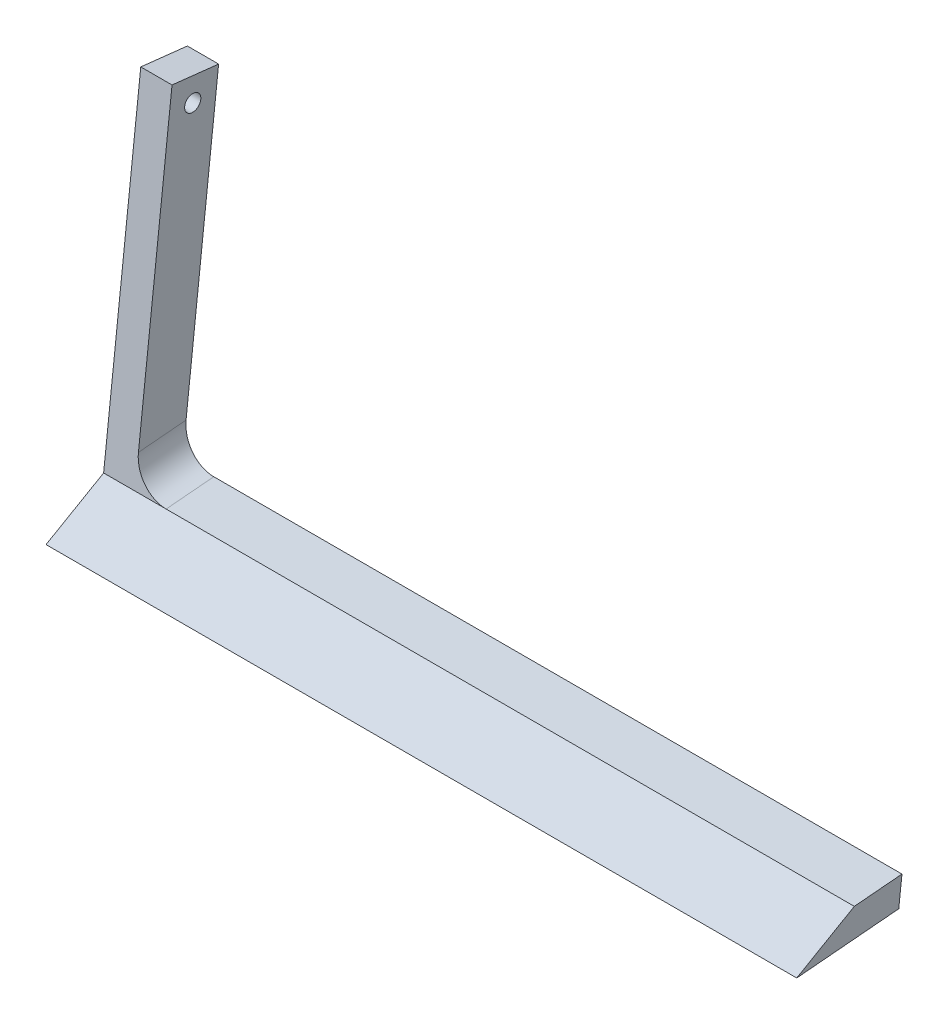
from build123d import *

# Parameters (mm, degrees)
SKETCH1_R           = 0.5
SKETCH1_R_2         = 2.35
BOSS_EXTRUDE1_DEPTH = 6.35
BOSS_EXTRUDE2_DEPTH = 146.15
FILLET1_R           = 6.35
BOSS_EXTRUDE3_START = -3.175
SKETCH3_R           = 2.35
SKETCH3_R_2         = 1.65
BOSS_EXTRUDE3_DEPTH = 3.175


with BuildPart() as part:
    # Sketch1 → Boss-Extrude1 (new body)
    # profile 1 of 6: a face of its own
    with BuildSketch(Plane(origin=(-0.241133717, 0, 0), x_dir=(0, 0, -1), z_dir=(1, 0, 0))):
        Polygon((-324.298707694, 301.481270763), (-335.997730617, 294.726836729), (-315.265512147, 296.540670815), (-310.789920597, 336.684836729), (-320.373933602, 336.684836729), align=None)
    # profile 2 of 6: a face of its own
    with BuildSketch(Plane(origin=(-0.241133717, 0, 0), x_dir=(0, 0, -1), z_dir=(1, 0, 0))):
        with BuildLine():
            Line((-320.373933602, 336.684836729), (-310.789920597, 336.684836729))
            Line((-310.789920597, 336.684836729), (-308.183073809, 360.067151412))
            ThreePointArc((-308.183073809, 360.067151412), (-308.561069009, 359.673805672), (-308.974348052, 359.317713441))
            ThreePointArc((-308.974348052, 359.317713441), (-309.402003012, 358.785726579), (-309.54965251, 358.119319487))
            ThreePointArc((-309.54965251, 358.119319487), (-312.549454326, 355.084836729), (-315.549256143, 358.119319487))
            ThreePointArc((-315.549256143, 358.119319487), (-315.696905641, 358.785726579), (-316.124560601, 359.317713441))
            ThreePointArc((-316.124560601, 359.317713441), (-316.979869903, 360.141653883), (-317.649424173, 361.122535594))
            Line((-317.649424173, 361.122535594), (-320.373933602, 336.684836729))
        make_face()
        with Locations((-312.549454326, 344.184836729)):
            Circle(SKETCH1_R, mode=Mode.SUBTRACT)
    # profile 3 of 6: a face of its own
    with BuildSketch(Plane(origin=(-0.241133717, 0, 0), x_dir=(0, 0, -1), z_dir=(1, 0, 0))):
        with BuildLine():
            ThreePointArc((-308.974348052, 359.317713441), (-308.561069009, 359.673805672), (-308.183073809, 360.067151412))
            Line((-308.183073809, 360.067151412), (-307.449484479, 366.647137863))
            ThreePointArc((-307.449484479, 366.647137863), (-308.019066808, 367.506381831), (-308.73176901, 368.251217246))
            Line((-308.73176901, 368.251217246), (-315.311755461, 368.984806576))
            ThreePointArc((-315.311755461, 368.984806576), (-316.170999429, 368.415224248), (-316.915834844, 367.702522045))
            Line((-316.915834844, 367.702522045), (-317.649424173, 361.122535594))
            ThreePointArc((-317.649424173, 361.122535594), (-316.979869903, 360.141653883), (-316.124560601, 359.317713441))
            ThreePointArc((-316.124560601, 359.317713441), (-315.696905641, 358.785726579), (-315.549256143, 358.119319487))
            ThreePointArc((-315.549256143, 358.119319487), (-312.549454326, 355.084836729), (-309.54965251, 358.119319487))
            ThreePointArc((-309.54965251, 358.119319487), (-309.402003012, 358.785726579), (-308.974348052, 359.317713441))
        make_face()
        with Locations(Location((-312.549454326, 363.884836729, 0), (0, 0, 90))):
            Circle(SKETCH1_R_2, mode=Mode.SUBTRACT)
    # profile 4 of 6: a face of its own
    with BuildSketch(Plane(origin=(-0.241133717, 0, 0), x_dir=(0, 0, -1), z_dir=(1, 0, 0))):
        with BuildLine():
            ThreePointArc((-308.73176901, 368.251217246), (-308.019066808, 367.506381831), (-307.449484479, 366.647137863))
            Line((-307.449484479, 366.647137863), (-307.288587053, 368.09031982))
            Line((-307.288587053, 368.09031982), (-308.73176901, 368.251217246))
        make_face()
    # profile 5 of 6: a face of its own
    with BuildSketch(Plane(origin=(-0.241133717, 0, 0), x_dir=(0, 0, -1), z_dir=(1, 0, 0))):
        with BuildLine():
            Line((-316.754937418, 369.145704002), (-316.915834844, 367.702522045))
            ThreePointArc((-316.915834844, 367.702522045), (-316.170999429, 368.415224248), (-315.311755461, 368.984806576))
            Line((-315.311755461, 368.984806576), (-316.754937418, 369.145704002))
        make_face()
    # profile 6 of 6: a face of its own
    with BuildSketch(Plane(origin=(-0.241133717, 0, 0), x_dir=(0, 0, -1), z_dir=(1, 0, 0))):
        with Locations((-312.549454326, 344.184836729)):
            Circle(SKETCH1_R)
    extrude(amount=BOSS_EXTRUDE1_DEPTH)

    # Sketch2 → Boss-Extrude2 (add)
    with BuildSketch(Plane(origin=(6.108866283, 0, 0), x_dir=(0, 0, -1), z_dir=(1, 0, 0))):
        Polygon((-324.298707694, 301.481270763), (-314.620292068, 302.328022411), (-315.265512147, 296.540670815), (-335.997730617, 294.726836729), align=None)
    extrude(amount=BOSS_EXTRUDE2_DEPTH)

    # Fillet1
    fillet1_edges = [part.edges().sort_by_distance(p)[0] for p in [
        (6.108866283, 301.904646587, 319.459499881),
    ]]
    fillet(fillet1_edges, radius=FILLET1_R)

    # Sketch3 → Boss-Extrude3 (add)
    with BuildSketch(Plane(origin=(6.108866283, 0, 0), x_dir=(0, 0, -1), z_dir=(1, 0, 0)).offset(BOSS_EXTRUDE3_START)):
        with Locations(Location((-312.549454326, 363.884836729, 0), (0, 0, 90))):
            Circle(SKETCH3_R)
        with Locations(Location((-312.549454326, 363.884836729, 0), (0, 0, 90))):
            Circle(SKETCH3_R_2, mode=Mode.SUBTRACT)
    extrude(amount=BOSS_EXTRUDE3_DEPTH)


solid = part.part
